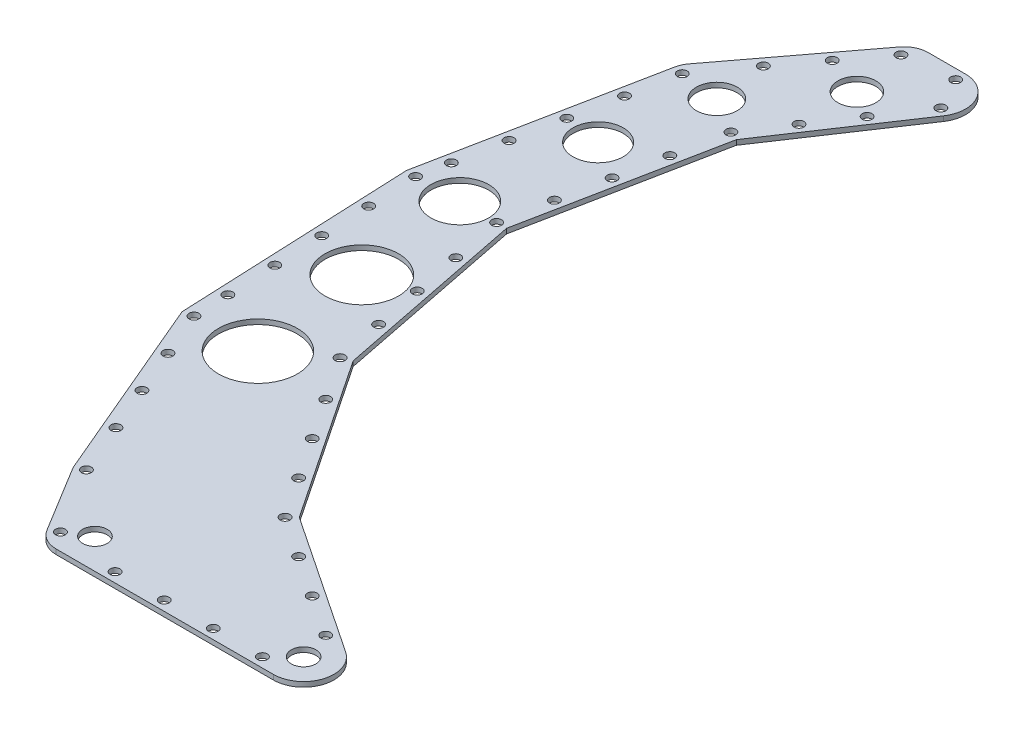
from build123d import *

# Parameters (mm, degrees)
ARM_DEPTH            = 2.54
LIGHTING_HOLES_REACH = 407.324
SKETCH3_R            = 10.563906398
SKETCH3_R_2          = 12.998589321
SKETCH3_R_3          = 14.959386689
SKETCH3_R_4          = 18.989420404
SKETCH3_R_5          = 20.414251761
SKETCH3_R_6          = 9.810598177
PIVOT_HOLES_REACH    = 407.324
SKETCH4_R            = 6.35
SKETCH5_R            = 2.54
EDGE_HOLES_DEPTH     = 2.54


with BuildPart() as part:
    # Sketch2 → Arm (new body)
    with BuildSketch(Plane(origin=(0, 0, 0), x_dir=(1, 0, 0), z_dir=(0, 1, 0))):
        with BuildLine():
            Line((-196.324159543, 163.36805283), (-239.26276826, 99.105883584))
            Line((-239.26276826, 99.105883584), (-258.976154185, 0))
            Line((-258.976154185, 0), (-239.26276826, -99.105883584))
            Line((-239.26276826, -99.105883584), (-183.12379479, -183.12379479))
            Line((-183.12379479, -183.12379479), (-110.768588535, -231.469997952))
            ThreePointArc((-110.768588535, -231.469997952), (-104.473118761, -249.064657285), (-119.482679559, -260.19650625))
            Line((-119.482679559, -260.19650625), (-231.805977786, -260.19650625))
            ThreePointArc((-231.805977786, -260.19650625), (-238.01719804, -258.573994365), (-242.641366534, -254.121032698))
            Line((-242.641366534, -254.121032698), (-263.949339301, -219.268704737))
            Line((-263.949339301, -219.268704737), (-305.536674142, -121.363782023))
            Line((-305.536674142, -121.363782023), (-310.771385022, 0))
            Line((-310.771385022, 0), (-287.766347466, 115.654133822))
            ThreePointArc((-287.766347466, 115.654133822), (-286.898137133, 118.373962558), (-285.444305631, 120.831121792))
            Line((-285.444305631, 120.831121792), (-238.69541851, 182.721728369))
            ThreePointArc((-238.69541851, 182.721728369), (-234.221705245, 186.435995307), (-228.561487284, 187.76709331))
            Line((-228.561487284, 187.76709331), (-209.365718386, 187.76709331))
            ThreePointArc((-209.365718386, 187.76709331), (-195.532827931, 179.475977845), (-196.324159543, 163.36805283))
        make_face()
    extrude(amount=ARM_DEPTH)

    # Sketch3 → Lighting Holes (cut, up to next)
    with BuildSketch(Plane(origin=(0, 2.54, 0), x_dir=(1, 0, 0), z_dir=(0, 1, 0)), mode=Mode.PRIVATE) as lighting_holes_sk1:
        with Locations(Location((-262.564493281, 112.317651632, 0), (0, 0, 270))):
            Circle(SKETCH3_R)
    lighting_holes_tool1 = extrude(lighting_holes_sk1.sketch, amount=-LIGHTING_HOLES_REACH, mode=Mode.PRIVATE) & part.part
    # Sketch3 → Lighting Holes (cut, up to next)
    with BuildSketch(Plane(origin=(0, 2.54, 0), x_dir=(1, 0, 0), z_dir=(0, 1, 0)), mode=Mode.PRIVATE) as lighting_holes_sk2:
        with Locations(Location((-273.830034517, 62.17947414, 0), (0, 0, 270))):
            Circle(SKETCH3_R_2)
    lighting_holes_tool2 = extrude(lighting_holes_sk2.sketch, amount=-LIGHTING_HOLES_REACH, mode=Mode.PRIVATE) & part.part
    # Sketch3 → Lighting Holes (cut, up to next)
    with BuildSketch(Plane(origin=(0, 2.54, 0), x_dir=(1, 0, 0), z_dir=(0, 1, 0)), mode=Mode.PRIVATE) as lighting_holes_sk3:
        with Locations(Location((-283.210721504, 0, 0), (0, 0, 270))):
            Circle(SKETCH3_R_3)
    lighting_holes_tool3 = extrude(lighting_holes_sk3.sketch, amount=-LIGHTING_HOLES_REACH, mode=Mode.PRIVATE) & part.part
    # Sketch3 → Lighting Holes (cut, up to next)
    with BuildSketch(Plane(origin=(0, 2.54, 0), x_dir=(1, 0, 0), z_dir=(0, 1, 0)), mode=Mode.PRIVATE) as lighting_holes_sk4:
        with Locations(Location((-275.563082601, -58.328881999, 0), (0, 0, 270))):
            Circle(SKETCH3_R_4)
    lighting_holes_tool4 = extrude(lighting_holes_sk4.sketch, amount=-LIGHTING_HOLES_REACH, mode=Mode.PRIVATE) & part.part
    # Sketch3 → Lighting Holes (cut, up to next)
    with BuildSketch(Plane(origin=(0, 2.54, 0), x_dir=(1, 0, 0), z_dir=(0, 1, 0)), mode=Mode.PRIVATE) as lighting_holes_sk5:
        with Locations(Location((-268.251334815, -119.393093751, 0), (0, 0, 270))):
            Circle(SKETCH3_R_5)
    lighting_holes_tool5 = extrude(lighting_holes_sk5.sketch, amount=-LIGHTING_HOLES_REACH, mode=Mode.PRIVATE) & part.part
    # Sketch3 → Lighting Holes (cut, up to next)
    with BuildSketch(Plane(origin=(0, 2.54, 0), x_dir=(1, 0, 0), z_dir=(0, 1, 0)), mode=Mode.PRIVATE) as lighting_holes_sk6:
        with Locations(Location((-229.533929598, 151.758024286, 0), (0, 0, 270))):
            Circle(SKETCH3_R_6)
    lighting_holes_tool6 = extrude(lighting_holes_sk6.sketch, amount=-LIGHTING_HOLES_REACH, mode=Mode.PRIVATE) & part.part
    add(lighting_holes_tool1.solids().sort_by_distance((-262.564493, 2.54, -112.317652))[0], mode=Mode.SUBTRACT)
    add(lighting_holes_tool2.solids().sort_by_distance((-273.830035, 2.54, -62.179474))[0], mode=Mode.SUBTRACT)
    add(lighting_holes_tool3.solids().sort_by_distance((-283.210722, 2.54, 0))[0], mode=Mode.SUBTRACT)
    add(lighting_holes_tool4.solids().sort_by_distance((-275.563083, 2.54, 58.328882))[0], mode=Mode.SUBTRACT)
    add(lighting_holes_tool5.solids().sort_by_distance((-268.251335, 2.54, 119.393094))[0], mode=Mode.SUBTRACT)
    add(lighting_holes_tool6.solids().sort_by_distance((-229.53393, 2.54, -151.758024))[0], mode=Mode.SUBTRACT)

    # Sketch4 → Pivot Holes (cut, up to next)
    with BuildSketch(Plane(origin=(0, 2.54, 0), x_dir=(1, 0, 0), z_dir=(0, 1, 0)), mode=Mode.PRIVATE) as pivot_holes_sk1:
        with Locations(Location((-119.482679559, -244.511556794, 0), (0, 0, 270))):
            Circle(SKETCH4_R)
    pivot_holes_tool1 = extrude(pivot_holes_sk1.sketch, amount=-PIVOT_HOLES_REACH, mode=Mode.PRIVATE) & part.part
    # Sketch4 → Pivot Holes (cut, up to next)
    with BuildSketch(Plane(origin=(0, 2.54, 0), x_dir=(1, 0, 0), z_dir=(0, 1, 0)), mode=Mode.PRIVATE) as pivot_holes_sk2:
        with Locations(Location((-227.432679559, -244.511556794, 0), (0, 0, 270))):
            Circle(SKETCH4_R)
    pivot_holes_tool2 = extrude(pivot_holes_sk2.sketch, amount=-PIVOT_HOLES_REACH, mode=Mode.PRIVATE) & part.part
    add(pivot_holes_tool1.solids().sort_by_distance((-119.48268, 2.54, 244.511557))[0], mode=Mode.SUBTRACT)
    add(pivot_holes_tool2.solids().sort_by_distance((-227.43268, 2.54, 244.511557))[0], mode=Mode.SUBTRACT)

    # Sketch5 → Edge Holes (cut)
    with BuildSketch(Plane(origin=(0, 2.54, 0), x_dir=(1, 0, 0), z_dir=(0, 1, 0))):
        with Locations(Location((-186.786270686, -186.786270686, 0), (0, 0, 270))):
            Circle(SKETCH5_R)
        with Locations(Location((-200.897754604, -165.666942533, 0), (0, 0, 270))):
            Circle(SKETCH5_R)
        with Locations(Location((-215.009238523, -144.547614381, 0), (0, 0, 270))):
            Circle(SKETCH5_R)
        with Locations(Location((-229.120722442, -123.428286228, 0), (0, 0, 270))):
            Circle(SKETCH5_R)
        with Locations(Location((-244.048023625, -101.088001256, 0), (0, 0, 270))):
            Circle(SKETCH5_R)
        with Locations(Location((-249.003317804, -76.176055134, 0), (0, 0, 270))):
            Circle(SKETCH5_R)
        with Locations(Location((-253.958611984, -51.264109011, 0), (0, 0, 270))):
            Circle(SKETCH5_R)
        with Locations(Location((-258.913906163, -26.352162889, 0), (0, 0, 270))):
            Circle(SKETCH5_R)
        with Locations(Location((-264.155677269, 0, 0), (0, 0, 270))):
            Circle(SKETCH5_R)
        with Locations(Location((-259.200383089, 24.911946122, 0), (0, 0, 270))):
            Circle(SKETCH5_R)
        with Locations(Location((-254.24508891, 49.823892244, 0), (0, 0, 270))):
            Circle(SKETCH5_R)
        with Locations(Location((-249.289794731, 74.735838367, 0), (0, 0, 270))):
            Circle(SKETCH5_R)
        with Locations(Location((-244.048023625, 101.088001256, 0), (0, 0, 270))):
            Circle(SKETCH5_R)
        with Locations(Location((-229.936539706, 122.207329408, 0), (0, 0, 270))):
            Circle(SKETCH5_R)
        with Locations(Location((-215.825055788, 143.326657561, 0), (0, 0, 270))):
            Circle(SKETCH5_R)
        with Locations(Location((-200.548025174, 166.190349614, 0), (0, 0, 270))):
            Circle(SKETCH5_R)
        with Locations(Location((-209.365718386, 182.68709331, 0), (0, 0, 270))):
            Circle(SKETCH5_R)
        with Locations(Location((-249.95111614, 159.392011893, 0), (0, 0, 270))):
            Circle(SKETCH5_R)
        with Locations(Location((-234.64184602, 179.659874346, 0), (0, 0, 270))):
            Circle(SKETCH5_R)
        with Locations(Location((-265.26038626, 139.12414944, 0), (0, 0, 270))):
            Circle(SKETCH5_R)
        with Locations(Location((-282.783958242, 114.663074986, 0), (0, 0, 270))):
            Circle(SKETCH5_R)
        with Locations(Location((-287.739252421, 89.751128864, 0), (0, 0, 270))):
            Circle(SKETCH5_R)
        with Locations(Location((-292.6945466, 64.839182741, 0), (0, 0, 270))):
            Circle(SKETCH5_R)
        with Locations(Location((-297.649840779, 39.927236619, 0), (0, 0, 270))):
            Circle(SKETCH5_R)
        with Locations(Location((-302.605134959, 15.015290497, 0), (0, 0, 270))):
            Circle(SKETCH5_R)
        with Locations(Location((-305.66976845, -0.391662485, 0), (0, 0, 270))):
            Circle(SKETCH5_R)
        with Locations(Location((-304.57522323, -25.768068274, 0), (0, 0, 270))):
            Circle(SKETCH5_R)
        with Locations(Location((-303.480678011, -51.144474063, 0), (0, 0, 270))):
            Circle(SKETCH5_R)
        with Locations(Location((-302.386132791, -76.520879852, 0), (0, 0, 270))):
            Circle(SKETCH5_R)
        with Locations(Location((-301.291587571, -101.89728564, 0), (0, 0, 270))):
            Circle(SKETCH5_R)
        with Locations(Location((-300.501066349, -120.225068676, 0), (0, 0, 270))):
            Circle(SKETCH5_R)
        with Locations(Location((-290.570595895, -143.603386762, 0), (0, 0, 270))):
            Circle(SKETCH5_R)
        with Locations(Location((-280.640125441, -166.981704849, 0), (0, 0, 270))):
            Circle(SKETCH5_R)
        with Locations(Location((-270.709654987, -190.360022936, 0), (0, 0, 270))):
            Circle(SKETCH5_R)
        with Locations(Location((-259.419983104, -216.93817365, 0), (0, 0, 270))):
            Circle(SKETCH5_R)
        with Locations(Location((-238.307211035, -251.471222119, 0), (0, 0, 270))):
            Circle(SKETCH5_R)
        with Locations(Location((-206.405977786, -255.11650625, 0), (0, 0, 270))):
            Circle(SKETCH5_R)
        with Locations(Location((-181.005977786, -255.11650625, 0), (0, 0, 270))):
            Circle(SKETCH5_R)
        with Locations(Location((-155.605977786, -255.11650625, 0), (0, 0, 270))):
            Circle(SKETCH5_R)
        with Locations(Location((-130.205977786, -255.11650625, 0), (0, 0, 270))):
            Circle(SKETCH5_R)
        with Locations(Location((-165.666942533, -200.897754604, 0), (0, 0, 270))):
            Circle(SKETCH5_R)
        with Locations(Location((-144.547614381, -215.009238523, 0), (0, 0, 270))):
            Circle(SKETCH5_R)
        with Locations(Location((-123.428286228, -229.120722442, 0), (0, 0, 270))):
            Circle(SKETCH5_R)
    extrude(amount=-EDGE_HOLES_DEPTH, mode=Mode.SUBTRACT)


solid = part.part
